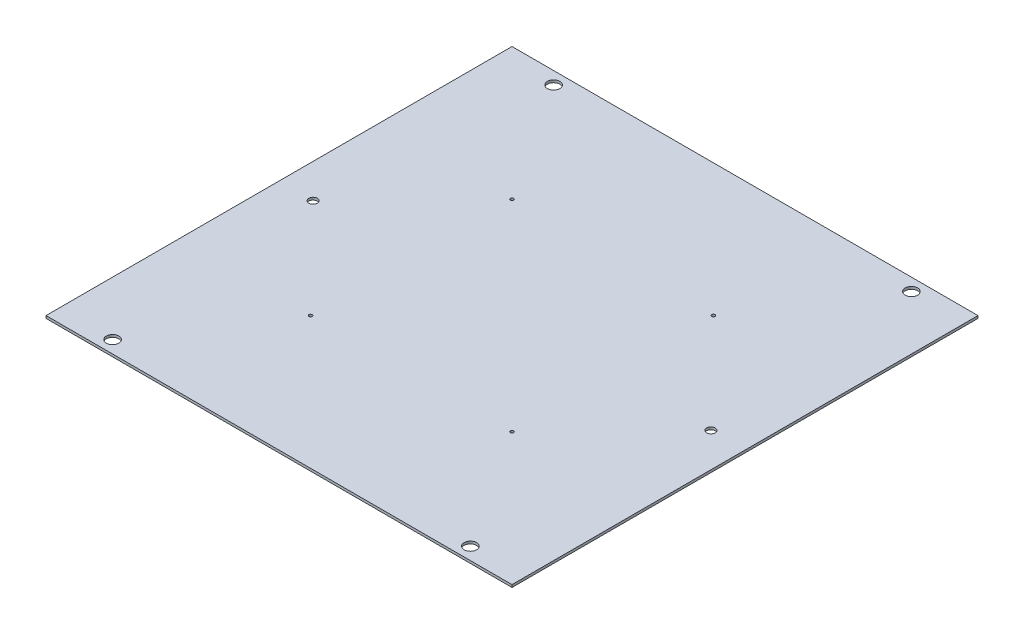
from build123d import *

# Parameters (mm, degrees)
SKETCH1_W             = 560
SKETCH1_H             = 560
BOSS_EXTRUDE1_DEPTH   = 3
F_4_0MM_DOWEL_HOLE1_D = 4
SKETCH5_R             = 5.15
CUT_EXTRUDE1_DEPTH    = 10
SKETCH6_R             = 7.5
CUT_EXTRUDE2_DEPTH    = 10


with BuildPart() as part:
    # Sketch1 → Boss-Extrude1 (new body)
    with BuildSketch(Plane(origin=(0, 0, 0), x_dir=(1, 0, 0), z_dir=(0, 1, 0))):
        with Locations((280, 280)):
            Rectangle(SKETCH1_W, SKETCH1_H)
    extrude(amount=BOSS_EXTRUDE1_DEPTH)

    # Ø4.0mm Dowel Hole1 (through all)
    with Locations(Plane(origin=(0, 3, 0), x_dir=(1, 0, 0), z_dir=(0, 1, 0))):
        with Locations((159, 159), (401, 159), (401, 401), (159, 401)):
            Hole(F_4_0MM_DOWEL_HOLE1_D / 2)

    # Sketch5 → Cut-Extrude1 (cut)
    with BuildSketch(Plane(origin=(0, 3, 0), x_dir=(1, 0, 0), z_dir=(0, 1, 0))):
        with Locations(Location((41, 280, 0), (0, 0, 270))):
            Circle(SKETCH5_R)
        with Locations(Location((519, 280, 0), (0, 0, 270))):
            Circle(SKETCH5_R)
    extrude(amount=-CUT_EXTRUDE1_DEPTH, mode=Mode.SUBTRACT)

    # Sketch6 → Cut-Extrude2 (cut)
    with BuildSketch(Plane(origin=(0, 3, 0), x_dir=(1, 0, 0), z_dir=(0, 1, 0))):
        with Locations(Location((495, 15, 0), (0, 0, 270))):
            Circle(SKETCH6_R)
        with Locations(Location((65, 15, 0), (0, 0, 270))):
            Circle(SKETCH6_R)
        with Locations(Location((495, 545, 0), (0, 0, 90))):
            Circle(SKETCH6_R)
        with Locations(Location((65, 545, 0), (0, 0, 90))):
            Circle(SKETCH6_R)
    extrude(amount=-CUT_EXTRUDE2_DEPTH, mode=Mode.SUBTRACT)


solid = part.part
